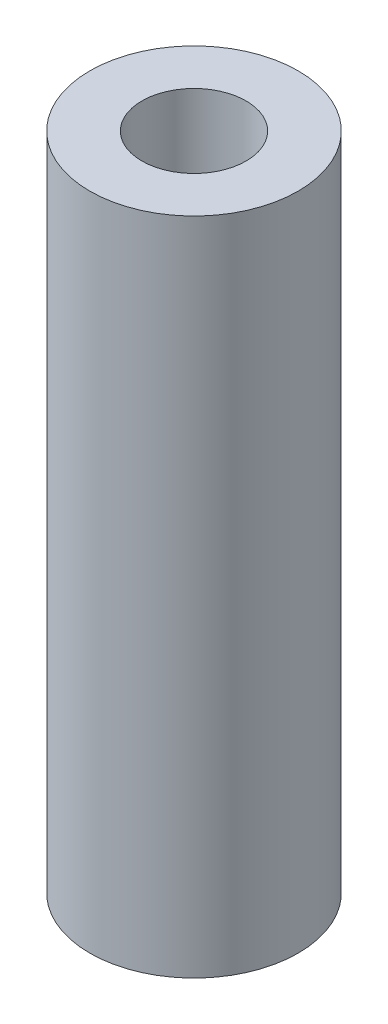
from build123d import *

# Parameters (mm, degrees)
SKETCH1_R           = 3
SKETCH1_R_2         = 1.5
BOSS_EXTRUDE1_DEPTH = 19


with BuildPart() as part:
    # Sketch1 → Boss-Extrude1 (new body)
    with BuildSketch(Plane(origin=(0, 0, 0), x_dir=(1, 0, 0), z_dir=(0, 1, 0))):
        with Locations(Location((0, 0, 0), (0, 0, 270))):
            Circle(SKETCH1_R)
        with Locations(Location((0, 0, 0), (0, 0, 270))):
            Circle(SKETCH1_R_2, mode=Mode.SUBTRACT)
    extrude(amount=BOSS_EXTRUDE1_DEPTH)


solid = part.part
